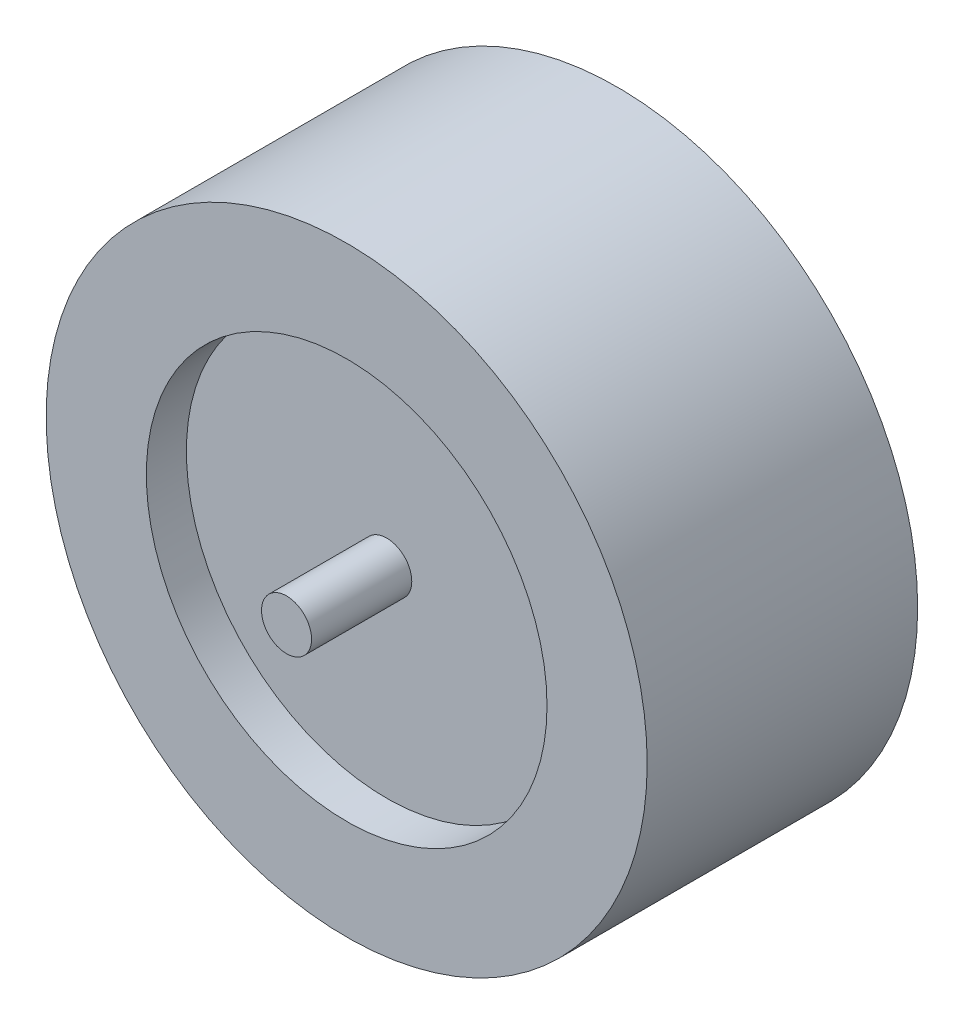
from build123d import *

# Parameters (mm, degrees)
SKETCH1_R                = 30
BOSS_EXTRUDE1_DEPTH      = 27
SKETCH3_R                = 20
CUT_EXTRUDE1_DEPTH       = 4
CUT_EXTRUDE2_START       = -4
SKETCH4_R                = 20
CUT_EXTRUDE2_DEPTH       = 4
BOSS_EXTRUDE2_DEPTH      = 10
BOSS_EXTRUDE2_DEPTH_BACK = 30
SKETCH5_R                = 2.5


with BuildPart() as part:
    # Sketch1 → Boss-Extrude1 (new body)
    with BuildSketch(Plane.XY):
        Circle(SKETCH1_R)
    extrude(amount=BOSS_EXTRUDE1_DEPTH)

    # Sketch3 → Cut-Extrude1 (cut)
    with BuildSketch(Plane.XY.offset(27)):
        Circle(SKETCH3_R)
    extrude(amount=-CUT_EXTRUDE1_DEPTH, mode=Mode.SUBTRACT)

    # Sketch4 → Cut-Extrude2 (cut)
    with BuildSketch(Plane(origin=(0, 0, 0), x_dir=(-1, 0, 0), z_dir=(0, 0, -1)).offset(CUT_EXTRUDE2_START)):
        with Locations(Location((0, 0, 0), (0, 0, 180))):
            Circle(SKETCH4_R)
    extrude(amount=CUT_EXTRUDE2_DEPTH, mode=Mode.SUBTRACT)

    # Sketch5 → Boss-Extrude2 (add, two sides: drawn at the far end of the back side and taken through both)
    with BuildSketch(Plane.XY.offset(23).offset(-BOSS_EXTRUDE2_DEPTH_BACK)):
        Circle(SKETCH5_R)
    extrude(amount=BOSS_EXTRUDE2_DEPTH + BOSS_EXTRUDE2_DEPTH_BACK)


solid = part.part
